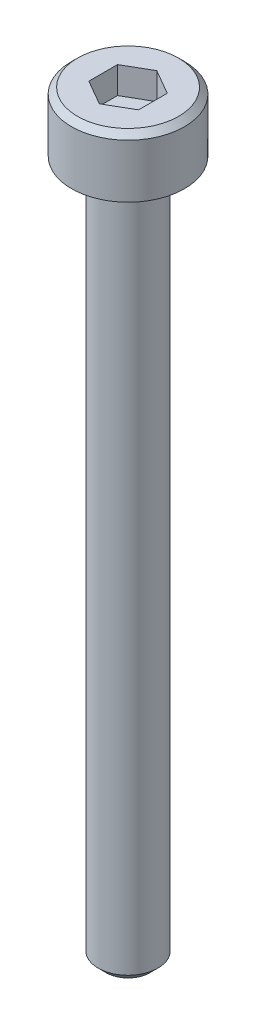
from build123d import *

# Parameters (mm, degrees)
CUT_EXTRUDE1_DEPTH = 1.35


with BuildPart() as part:
    # Sketch1 → Revolve1 (revolve)
    with BuildSketch(Plane.XY, mode=Mode.PRIVATE) as revolve1_sk:
        Polygon((0, -35), (1.1, -35), (1.5, -34.6), (1.5, 0), (2.84, 0), (2.84, 2.7), (2.54, 3), (0, 3), align=None)
    revolve(revolve1_sk.sketch.rotate(Axis((0, -10, 0), (0, 1, 0)), 90), axis=Axis((0, -10, 0), (0, 1, 0)))

    # Sketch2 → Cut-Extrude1 (cut)
    with BuildSketch(Plane(origin=(0, 3, 0), x_dir=(1, 0, 0), z_dir=(0, 1, 0))):
        Polygon((1.25, -0.721687836), (0, -1.443375673), (-1.25, -0.721687836), (-1.25, 0.721687836), (0, 1.443375673), (1.25, 0.721687836), align=None)
    extrude(amount=-CUT_EXTRUDE1_DEPTH, mode=Mode.SUBTRACT)


solid = part.part
